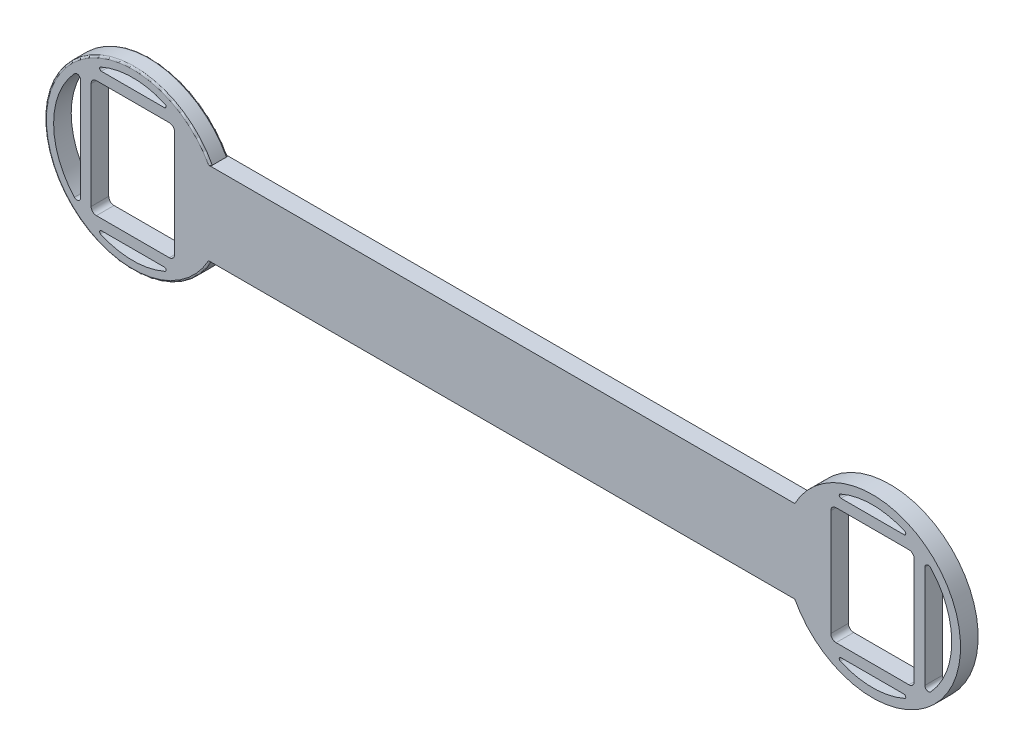
from build123d import *

# Parameters (mm, degrees)
SKETCH_1_W             = 47.4
SKETCH_1_H             = 66.4
EXTRUDE_1_DEPTH        = 10
FILLET_1_R             = 3
FILLET_2_R             = 2
FILLET_4_R             = 1
FILLET_5_R             = 1
FILLET_1_OF_MIRROR_1_R = 3
FILLET_2_OF_MIRROR_1_R = 2
FILLET_4_OF_MIRROR_1_R = 1


with BuildPart() as part:
    # 草图1 → 凸台-拉伸1 (new body)
    with BuildSketch(Plane.XY):
        with BuildLine():
            ThreePointArc((-165.866679255, 23.5), (-260, 0), (-165.866679255, -23.5))
            Line((-165.866679255, -23.5), (0, -23.5))
            Line((0, -23.5), (0, 23.5))
            Line((0, 23.5), (-165.866679255, 23.5))
        make_face()
        with BuildLine():
            ThreePointArc((-187.901131251, -39.2), (-210, -45), (-232.098868749, -39.2))
            Line((-232.098868749, -39.2), (-187.901131251, -39.2))
        make_face(mode=Mode.SUBTRACT)
        with BuildLine():
            ThreePointArc((-239.7, -33.806951948), (-255, 0), (-239.7, 33.806951948))
            Line((-239.7, 33.806951948), (-239.7, -33.806951948))
        make_face(mode=Mode.SUBTRACT)
        with Locations((-210, 0)):
            Rectangle(SKETCH_1_W, SKETCH_1_H, mode=Mode.SUBTRACT)
        with BuildLine():
            Line((-187.901131251, 39.2), (-232.098868749, 39.2))
            ThreePointArc((-232.098868749, 39.2), (-210, 45), (-187.901131251, 39.2))
        make_face(mode=Mode.SUBTRACT)
    extrude_1 = extrude(amount=EXTRUDE_1_DEPTH)

    # 圆角1
    fillet_1_edges = [part.edges().sort_by_distance(p)[0] for p in [
        (-186.3, 33.2, 5),
        (-233.7, 33.2, 5),
        (-233.7, -33.2, 5),
        (-186.3, -33.2, 5),
    ]]
    fillet(fillet_1_edges, radius=FILLET_1_R)

    # 圆角2
    fillet_2_edges = [part.edges().sort_by_distance(p)[0] for p in [
        (-239.7, 33.806951948, 5),
        (-239.7, -33.806951948, 5),
    ]]
    fillet(fillet_2_edges, radius=FILLET_2_R)

    # 圆角4
    fillet_4_edges = [part.edges().sort_by_distance(p)[0] for p in [
        (-187.901131251, 39.2, 5),
        (-232.098868749, 39.2, 5),
        (-187.901131251, -39.2, 5),
        (-232.098868749, -39.2, 5),
    ]]
    fillet(fillet_4_edges, radius=FILLET_4_R)

    # 圆角5
    fillet_5_edges = [part.edges().sort_by_distance(p)[0] for p in [
        (-260, 0, 10),
        (-260, 0, 0),
    ]]
    fillet(fillet_5_edges, radius=FILLET_5_R)

    # 镜向1: 凸台-拉伸1 across plane
    add(extrude_1.mirror(Plane(origin=(0, 0, 10), x_dir=(0, 0, 1), z_dir=(1, 0, 0))))

    # 圆角1 of 镜向1
    fillet_1_of_mirror_1_edges = [part.edges().sort_by_distance(p)[0] for p in [
        (186.3, 33.2, 5),
        (233.7, 33.2, 5),
        (233.7, -33.2, 5),
        (186.3, -33.2, 5),
    ]]
    fillet(fillet_1_of_mirror_1_edges, radius=FILLET_1_OF_MIRROR_1_R)

    # 圆角2 of 镜向1
    fillet_2_of_mirror_1_edges = [part.edges().sort_by_distance(p)[0] for p in [
        (239.7, 33.806951948, 5),
        (239.7, -33.806951948, 5),
    ]]
    fillet(fillet_2_of_mirror_1_edges, radius=FILLET_2_OF_MIRROR_1_R)

    # 圆角4 of 镜向1
    fillet_4_of_mirror_1_edges = [part.edges().sort_by_distance(p)[0] for p in [
        (187.901131251, 39.2, 5),
        (232.098868749, 39.2, 5),
        (187.901131251, -39.2, 5),
        (232.098868749, -39.2, 5),
    ]]
    fillet(fillet_4_of_mirror_1_edges, radius=FILLET_4_OF_MIRROR_1_R)


solid = part.part
